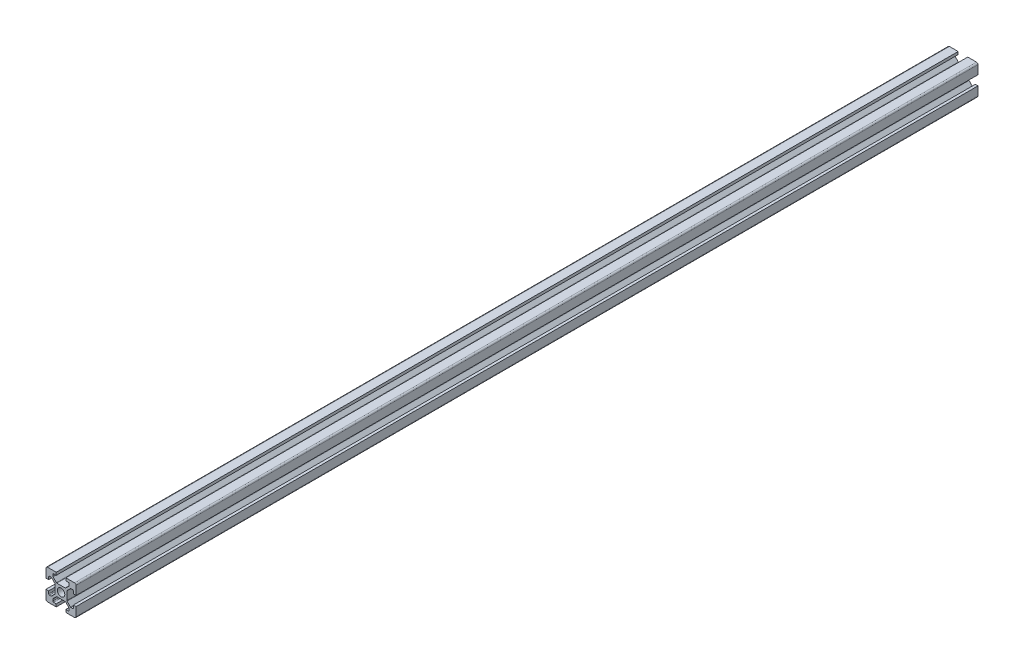
from build123d import *

# Parameters (mm, degrees)
SKETCH1_R           = 2.5
BOSS_EXTRUDE1_DEPTH = 300
FILLET1_R           = 1
FILLET2_R           = 0.5
FILLET3_R           = 0.5
FILLET4_R           = 0.5
FILLET5_R           = 0.5


with BuildPart() as part:
    # Sketch1 → Boss-Extrude1 (new body)
    with BuildSketch(Plane.XY):
        Polygon((13.2, 0), (13.2, 1.8), (15.45, 1.8), (15.45, 3.6), (12.95, 6.1), (7.05, 6.1), (4.55, 3.6), (4.55, 1.8), (6.8, 1.8), (6.8, 0), (0, 0), (0, 6.8), (1.8, 6.8), (1.8, 4.55), (3.6, 4.55), (6.1, 7.05), (6.1, 12.95), (3.6, 15.45), (1.8, 15.45), (1.8, 13.2), (0, 13.2), (0, 20), (6.8, 20), (6.8, 18.2), (4.55, 18.2), (4.55, 16.4), (7.05, 13.9), (12.95, 13.9), (15.45, 16.4), (15.45, 18.2), (13.2, 18.2), (13.2, 20), (20, 20), (20, 13.2), (18.2, 13.2), (18.2, 15.45), (16.4, 15.45), (13.9, 12.95), (13.9, 7.05), (16.4, 4.55), (18.2, 4.55), (18.2, 6.8), (20, 6.8), (20, 0), align=None)
        with Locations((10, 10)):
            Circle(SKETCH1_R, mode=Mode.SUBTRACT)
    extrude(amount=BOSS_EXTRUDE1_DEPTH)

    # Fillet1
    fillet1_edges = [part.edges().sort_by_distance(p)[0] for p in [
        (0, 0, 150),
        (0, 20, 150),
        (20, 20, 150),
        (20, 0, 150),
    ]]
    fillet(fillet1_edges, radius=FILLET1_R)

    # Fillet2
    fillet2_edges = [part.edges().sort_by_distance(p)[0] for p in [
        (4.55, 18.2, 150),
        (4.55, 16.4, 150),
        (7.05, 13.9, 150),
        (12.95, 13.9, 150),
        (15.45, 16.4, 150),
        (15.45, 18.2, 150),
    ]]
    fillet(fillet2_edges, radius=FILLET2_R)

    # Fillet3
    fillet3_edges = [part.edges().sort_by_distance(p)[0] for p in [
        (18.2, 15.45, 150),
        (16.4, 15.45, 150),
        (13.9, 12.95, 150),
        (13.9, 7.05, 150),
        (16.4, 4.55, 150),
        (18.2, 4.55, 150),
    ]]
    fillet(fillet3_edges, radius=FILLET3_R)

    # Fillet4
    fillet4_edges = [part.edges().sort_by_distance(p)[0] for p in [
        (1.8, 4.55, 150),
        (3.6, 4.55, 150),
        (6.1, 7.05, 150),
        (6.1, 12.95, 150),
        (3.6, 15.45, 150),
        (1.8, 15.45, 150),
    ]]
    fillet(fillet4_edges, radius=FILLET4_R)

    # Fillet5
    fillet5_edges = [part.edges().sort_by_distance(p)[0] for p in [
        (15.45, 1.8, 150),
        (15.45, 3.6, 150),
        (12.95, 6.1, 150),
        (7.05, 6.1, 150),
        (4.55, 3.6, 150),
        (4.55, 1.8, 150),
    ]]
    fillet(fillet5_edges, radius=FILLET5_R)

    # Mirror1: part across plane


with BuildPart() as part_1:
    add(part.part)
    add(part.part.mirror(Plane.XY.offset(300)))


solid = part_1.part
